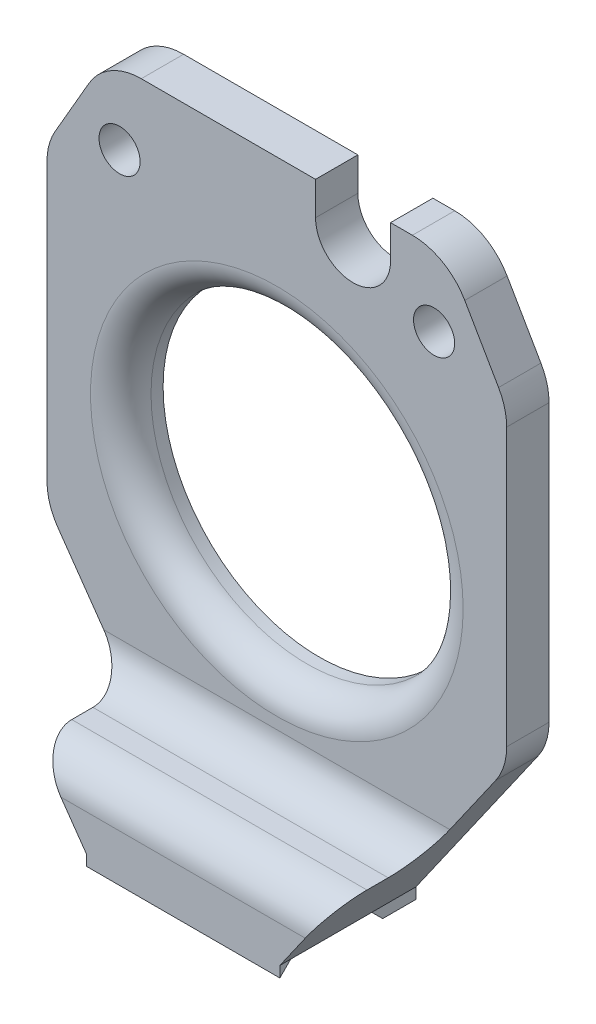
from build123d import *

# Parameters (mm, degrees)
SKETCH1_R           = 1.7
SKETCH1_R_2         = 12.9
BOSS_EXTRUDE1_DEPTH = 3.5
FILLET1_R           = 2.5
FILLET2_R           = 5
BOSS_EXTRUDE2_DEPTH = 7.75
FILLET3_R           = 3
SKETCH3_R           = 3.2
CUT_EXTRUDE1_DEPTH  = 3.1
SKETCH4_R           = 2
CUT_EXTRUDE2_DEPTH  = 1.75
SKETCH5_R           = 0.85
CUT_EXTRUDE3_DEPTH  = 7
CUT_EXTRUDE4_DEPTH  = 2
BOSS_EXTRUDE3_DEPTH = 16
CUT_EXTRUDE5_DEPTH  = 34.12193382


with BuildPart() as part:
    # Sketch1 → Boss-Extrude1 (new body)
    with BuildSketch(Plane.XY):
        Polygon((-19, -8.290371926), (-19, 17.5), (-14.092522712, 26), (14.092522712, 26), (19, 17.5), (19, -8.290371926), (8, -24), (-8, -24), align=None)
        with Locations((-13, 20)):
            Circle(SKETCH1_R, mode=Mode.SUBTRACT)
        with Locations((13, 20)):
            Circle(SKETCH1_R, mode=Mode.SUBTRACT)
        with Locations((0, 1.35)):
            Circle(SKETCH1_R_2, mode=Mode.SUBTRACT)
    extrude(amount=BOSS_EXTRUDE1_DEPTH)

    # Fillet1
    fillet1_edges = [part.edges().sort_by_distance(p)[0] for p in [
        (-12.9, 1.35, 3.5),
    ]]
    fillet(fillet1_edges, radius=FILLET1_R)

    # Fillet2
    fillet2_edges = [part.edges().sort_by_distance(p)[0] for p in [
        (-19, -8.290371926, 1.75),
        (-19, 17.5, 1.75),
        (-14.092522712, 26, 1.75),
        (14.092522712, 26, 1.75),
        (19, 17.5, 1.75),
        (19, -8.290371926, 1.75),
    ]]
    fillet(fillet2_edges, radius=FILLET2_R)

    # Sketch2 → Boss-Extrude2 (add)
    with BuildSketch(Plane.XY.offset(3.5)):
        Polygon((-12.201245229, -18), (-8, -24), (8, -24), (12.201245229, -18), align=None)
    extrude(amount=BOSS_EXTRUDE2_DEPTH)

    # Fillet3
    fillet3_edges = [part.edges().sort_by_distance(p)[0] for p in [
        (0, -18, 3.5),
        (0, -18, 11.25),
    ]]
    fillet(fillet3_edges, radius=FILLET3_R)

    # Sketch3 → Cut-Extrude1 (cut)
    with BuildSketch(Plane.XZ.offset(24)):
        with Locations(Location((-4.25, 7, 0), (0, 0, 270))):
            Circle(SKETCH3_R)
        with Locations(Location((4.25, 7, 0), (0, 0, 270))):
            Circle(SKETCH3_R)
    extrude(amount=-CUT_EXTRUDE1_DEPTH, mode=Mode.SUBTRACT)

    # Sketch4 → Cut-Extrude2 (cut)
    with BuildSketch(Plane.XZ.offset(20.9)):
        with Locations(Location((-4.25, 7, 0), (0, 0, 270))):
            Circle(SKETCH4_R)
        with Locations(Location((4.25, 7, 0), (0, 0, 270))):
            Circle(SKETCH4_R)
    extrude(amount=-CUT_EXTRUDE2_DEPTH, mode=Mode.SUBTRACT)

    # Sketch5 → Cut-Extrude3 (cut)
    with BuildSketch(Plane(origin=(0, 0, 0), x_dir=(-1, 0, 0), z_dir=(0, 0, -1))):
        with Locations((4.25, -20.225)):
            Circle(SKETCH5_R)
        with Locations((-4.25, -20.225)):
            Circle(SKETCH5_R)
    extrude(amount=-CUT_EXTRUDE3_DEPTH, mode=Mode.SUBTRACT)

    # Sketch6 → Cut-Extrude4 (cut)
    with BuildSketch(Plane(origin=(0, 0, 0), x_dir=(-1, 0, 0), z_dir=(0, 0, -1))):
        with BuildLine():
            Line((18.330127019, 18.660254038), (16.598076211, 21.660254038))
            Line((16.598076211, 21.660254038), (15.267949192, 19.356406461))
            ThreePointArc((15.267949192, 19.356406461), (15.068148347, 18.874044551), (15, 18.356406461))
            Line((15, 18.356406461), (15, -6.398579193))
            ThreePointArc((15, -6.398579193), (14.907433901, -6.999990792), (14.638304089, -7.545732065))
            Line((14.638304089, -7.545732065), (7.862801296, -17.222152873))
            ThreePointArc((7.862801296, -17.222152873), (7.147994434, -17.849021666), (6.224497208, -18.075))
            Line((6.224497208, -18.075), (-3.1, -18.075))
            ThreePointArc((-3.1, -18.075), (-4.514213562, -18.660786438), (-5.1, -20.075))
            Line((-5.1, -20.075), (-5.1, -20.225))
            ThreePointArc((-5.1, -20.225), (-4.851040764, -20.826040764), (-4.25, -21.075))
            Line((-4.25, -21.075), (4.25, -21.075))
            Line((4.25, -21.075), (7.786198359, -21.075))
            ThreePointArc((7.786198359, -21.075), (8.709695586, -20.849021666), (9.424502448, -20.222152873))
            Line((9.424502448, -20.222152873), (17.638304089, -8.491628432))
            ThreePointArc((17.638304089, -8.491628432), (17.907433901, -7.945887158), (18, -7.344475559))
            Line((18, -7.344475559), (18, 17.552558883))
            ThreePointArc((18, 17.552558883), (18.068148347, 18.070196973), (18.267949192, 18.552558883))
            Line((18.267949192, 18.552558883), (18.330127019, 18.660254038))
        make_face()
    extrude(amount=-CUT_EXTRUDE4_DEPTH, mode=Mode.SUBTRACT)

    # Sketch7 → Boss-Extrude3 (add)
    with BuildSketch(Plane(origin=(8, 0, 0), x_dir=(0, 0, -1), z_dir=(1, 0, 0))):
        Polygon((-11.25, -24), (-11.25, -24.9), (-10.35, -24), align=None)
        Polygon((-2.75, -24.9), (-3.65, -24), (0, -24), (0, -24.9), align=None)
    extrude(amount=-BOSS_EXTRUDE3_DEPTH)

    # Sketch9 → Cut-Extrude5 (cut, through all)
    with BuildSketch(Plane.XY.offset(3.5)):
        with BuildLine():
            Line((3.2, 23.25), (3.2, 26))
            Line((3.2, 26), (9.4, 26))
            Line((9.4, 26), (9.4, 23.25))
            ThreePointArc((9.4, 23.25), (6.3, 20.15), (3.2, 23.25))
        make_face()
    extrude(amount=-CUT_EXTRUDE5_DEPTH, mode=Mode.SUBTRACT)


solid = part.part
